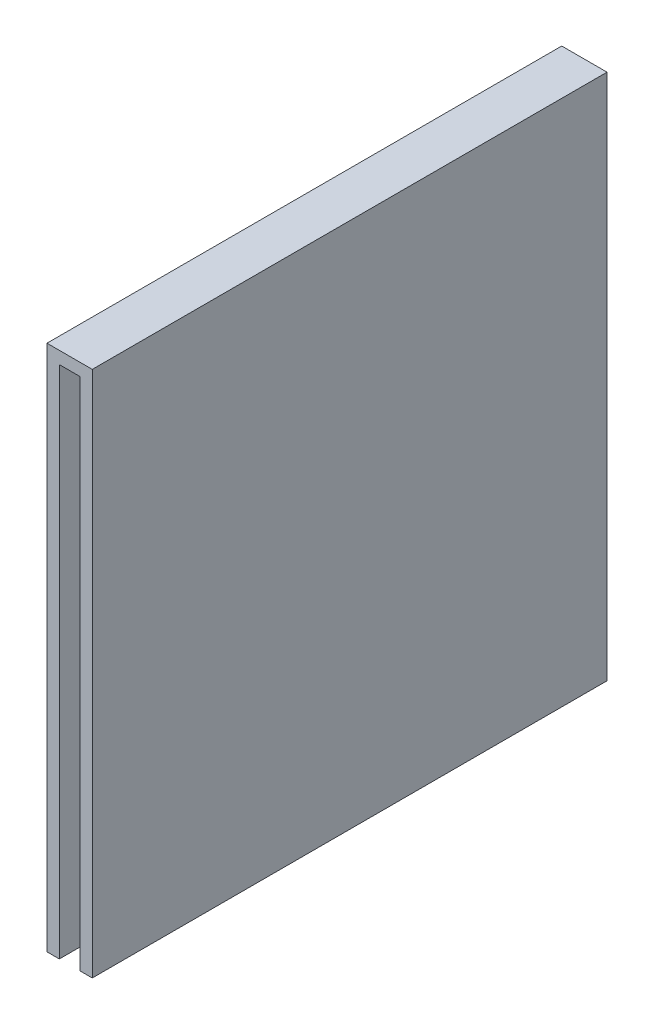
from build123d import *

# Parameters (mm, degrees)
EXTRUSION1_DEPTH = 12.5


with BuildPart() as part:
    # Esquisse1 → Extrusion1 (new body)
    with BuildSketch(Plane.XY):
        Polygon((-15.510421557, -19.512089202), (-15.510421557, -7.012089202), (-15.010421557, -7.012089202), (-15.010421557, -19.512089202), (-14.710421557, -19.512089202), (-14.710421557, -6.712089202), (-15.810421557, -6.712089202), (-15.810421557, -19.512089202), align=None)
    extrude(amount=EXTRUSION1_DEPTH)


solid = part.part
